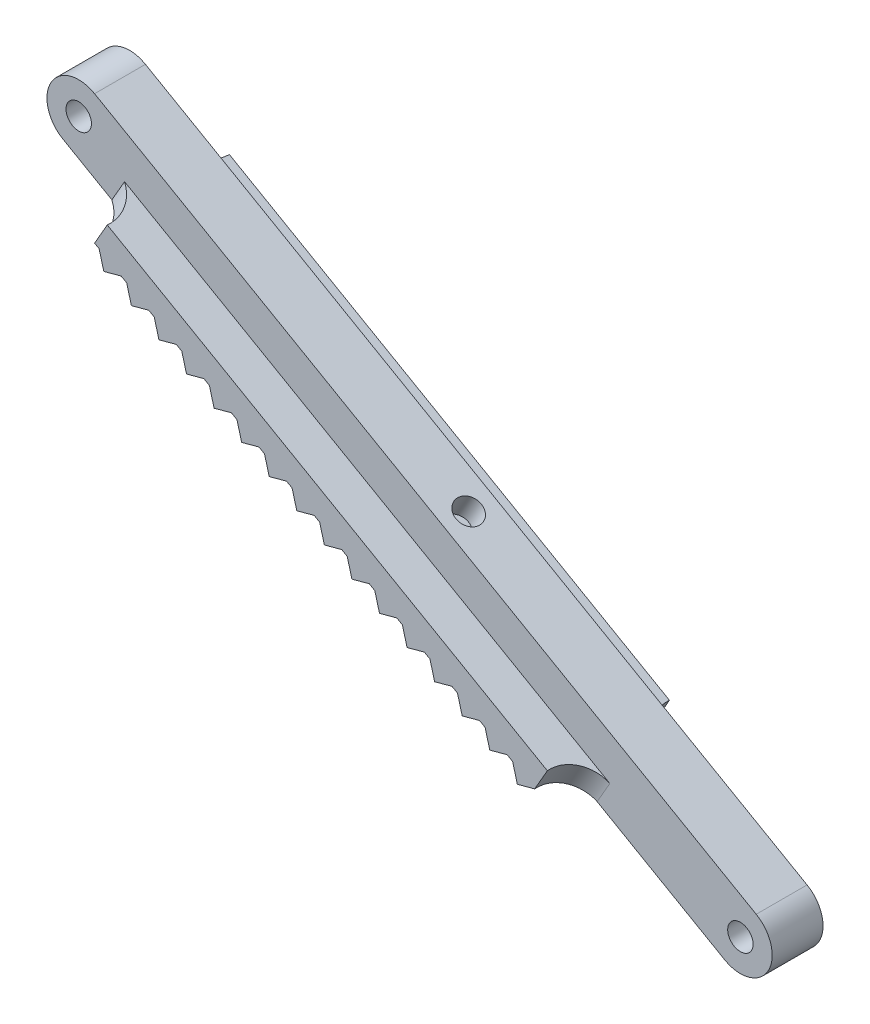
from build123d import *

# Parameters (mm, degrees)
SKETCH1_R           = 1
BOSS_EXTRUDE1_DEPTH = 4
SKETCH2_R           = 1
CUT_EXTRUDE1_DEPTH  = 2
BOSS_EXTRUDE2_DEPTH = 2
BOSS_EXTRUDE3_REACH = 89.691


with BuildPart() as part:
    # Sketch1 → Boss-Extrude1 (new body)
    with BuildSketch(Plane.XY):
        with BuildLine():
            Line((-56.056622595, 63.083032854), (-4.020390364, 33.212804613))
            ThreePointArc((-4.020390364, 33.212804613), (-3.096806864, 29.800035426), (-6.509576051, 28.876451927))
            Line((-6.509576051, 28.876451927), (-58.545808282, 58.746680168))
            ThreePointArc((-58.545808282, 58.746680168), (-59.469391781, 62.159449355), (-56.056622595, 63.083032854))
        make_face()
        with Locations((-57.301215438, 60.914856511)):
            Circle(SKETCH1_R, mode=Mode.SUBTRACT)
        with Locations((-5.264983207, 31.04462827)):
            Circle(SKETCH1_R, mode=Mode.SUBTRACT)
    extrude(amount=BOSS_EXTRUDE1_DEPTH)

    # Sketch2 → Cut-Extrude1 (cut)
    with BuildSketch(Plane(origin=(13.343522454, 23.245441166, 0), x_dir=(0.8672705371832455, -0.49783713735908147, 0), z_dir=(0.49783713735908147, 0.8672705371832455, 0))):
        with Locations(Location((-48.403705156, -2, 0), (0, 0, 180))):
            Circle(SKETCH2_R)
    extrude(amount=-CUT_EXTRUDE1_DEPTH, mode=Mode.SUBTRACT)

    # Sketch4 → Boss-Extrude2 (add)
    with BuildSketch(Plane(origin=(10.854336767, 18.90908848, 0), x_dir=(0.8672705371832455, -0.49783713735908136, 0), z_dir=(-0.49783713735908136, -0.8672705371832455, 0))):
        with BuildLine():
            Line((-73.918626185, 6.8), (-34.010435963, 6.8))
            ThreePointArc((-34.010435963, 6.8), (-33.372509372, 4.895560129), (-31.574784807, 4))
            Line((-31.574784807, 4), (-31.574784807, 0))
            ThreePointArc((-31.574784807, 0), (-33.372509372, -0.895560129), (-34.010435963, -2.8))
            Line((-34.010435963, -2.8), (-73.918626185, -2.8))
            ThreePointArc((-73.918626185, -2.8), (-74.749293349, -0.809525322), (-76.748459708, 0))
            Line((-76.748459708, 0), (-75.579913588, 4))
            ThreePointArc((-75.579913588, 4), (-74.306304145, 5.137180927), (-73.918626185, 6.8))
        make_face()
    extrude(amount=-BOSS_EXTRUDE2_DEPTH)

    # Boss-Extrude3: up to this face of the body (flat: up to its plane)
    boss_extrude3_end = Plane(part.part.faces().sort_by_distance((-35.449673949, 46.641906686, 6.8))[0])
    # Sketch5 → Boss-Extrude3 (add, up to the picked face)
    with BuildSketch(Plane(origin=(0, 0, -2.8), x_dir=(-1, 0, 0), z_dir=(0, 0, -1)), mode=Mode.PRIVATE) as boss_extrude3_sk1:
        Polygon((52.899098519, 55.505313486), (51.164557445, 54.509639211), (52.529665119, 54.140205811), align=None)
    boss_extrude3_tool1 = split(extrude(boss_extrude3_sk1.sketch, amount=-BOSS_EXTRUDE3_REACH, mode=Mode.PRIVATE), bisect_by=boss_extrude3_end, keep=Keep.BOTH, mode=Mode.PRIVATE)
    # Sketch5 → Boss-Extrude3 (add, up to the picked face)
    with BuildSketch(Plane(origin=(0, 0, -2.8), x_dir=(-1, 0, 0), z_dir=(0, 0, -1)), mode=Mode.PRIVATE) as boss_extrude3_sk2:
        Polygon((18.6419123, 35.84074656), (20.007019975, 35.47131316), (20.376453374, 36.836420835), align=None)
    boss_extrude3_tool2 = split(extrude(boss_extrude3_sk2.sketch, amount=-BOSS_EXTRUDE3_REACH, mode=Mode.PRIVATE), bisect_by=boss_extrude3_end, keep=Keep.BOTH, mode=Mode.PRIVATE)
    # Sketch5 → Boss-Extrude3 (add, up to the picked face)
    with BuildSketch(Plane(origin=(0, 0, -2.8), x_dir=(-1, 0, 0), z_dir=(0, 0, -1)), mode=Mode.PRIVATE) as boss_extrude3_sk3:
        Polygon((20.810088643, 37.085339404), (22.175196318, 36.715906004), (22.544629717, 38.081013678), align=None)
    boss_extrude3_tool3 = split(extrude(boss_extrude3_sk3.sketch, amount=-BOSS_EXTRUDE3_REACH, mode=Mode.PRIVATE), bisect_by=boss_extrude3_end, keep=Keep.BOTH, mode=Mode.PRIVATE)
    # Sketch5 → Boss-Extrude3 (add, up to the picked face)
    with BuildSketch(Plane(origin=(0, 0, -2.8), x_dir=(-1, 0, 0), z_dir=(0, 0, -1)), mode=Mode.PRIVATE) as boss_extrude3_sk4:
        Polygon((22.978264986, 38.329932247), (24.343372661, 37.960498847), (24.71280606, 39.325606522), align=None)
    boss_extrude3_tool4 = split(extrude(boss_extrude3_sk4.sketch, amount=-BOSS_EXTRUDE3_REACH, mode=Mode.PRIVATE), bisect_by=boss_extrude3_end, keep=Keep.BOTH, mode=Mode.PRIVATE)
    # Sketch5 → Boss-Extrude3 (add, up to the picked face)
    with BuildSketch(Plane(origin=(0, 0, -2.8), x_dir=(-1, 0, 0), z_dir=(0, 0, -1)), mode=Mode.PRIVATE) as boss_extrude3_sk5:
        Polygon((25.146441329, 39.57452509), (26.511549004, 39.205091691), (26.880982403, 40.570199365), align=None)
    boss_extrude3_tool5 = split(extrude(boss_extrude3_sk5.sketch, amount=-BOSS_EXTRUDE3_REACH, mode=Mode.PRIVATE), bisect_by=boss_extrude3_end, keep=Keep.BOTH, mode=Mode.PRIVATE)
    # Sketch5 → Boss-Extrude3 (add, up to the picked face)
    with BuildSketch(Plane(origin=(0, 0, -2.8), x_dir=(-1, 0, 0), z_dir=(0, 0, -1)), mode=Mode.PRIVATE) as boss_extrude3_sk6:
        Polygon((27.314617672, 40.819117934), (28.679725347, 40.449684534), (29.049158746, 41.814792208), align=None)
    boss_extrude3_tool6 = split(extrude(boss_extrude3_sk6.sketch, amount=-BOSS_EXTRUDE3_REACH, mode=Mode.PRIVATE), bisect_by=boss_extrude3_end, keep=Keep.BOTH, mode=Mode.PRIVATE)
    # Sketch5 → Boss-Extrude3 (add, up to the picked face)
    with BuildSketch(Plane(origin=(0, 0, -2.8), x_dir=(-1, 0, 0), z_dir=(0, 0, -1)), mode=Mode.PRIVATE) as boss_extrude3_sk7:
        Polygon((29.482794015, 42.063710777), (30.847901689, 41.694277377), (31.217335089, 43.059385052), align=None)
    boss_extrude3_tool7 = split(extrude(boss_extrude3_sk7.sketch, amount=-BOSS_EXTRUDE3_REACH, mode=Mode.PRIVATE), bisect_by=boss_extrude3_end, keep=Keep.BOTH, mode=Mode.PRIVATE)
    # Sketch5 → Boss-Extrude3 (add, up to the picked face)
    with BuildSketch(Plane(origin=(0, 0, -2.8), x_dir=(-1, 0, 0), z_dir=(0, 0, -1)), mode=Mode.PRIVATE) as boss_extrude3_sk8:
        Polygon((31.650970358, 43.308303621), (33.016078032, 42.938870221), (33.385511432, 44.303977895), align=None)
    boss_extrude3_tool8 = split(extrude(boss_extrude3_sk8.sketch, amount=-BOSS_EXTRUDE3_REACH, mode=Mode.PRIVATE), bisect_by=boss_extrude3_end, keep=Keep.BOTH, mode=Mode.PRIVATE)
    # Sketch5 → Boss-Extrude3 (add, up to the picked face)
    with BuildSketch(Plane(origin=(0, 0, -2.8), x_dir=(-1, 0, 0), z_dir=(0, 0, -1)), mode=Mode.PRIVATE) as boss_extrude3_sk9:
        Polygon((33.819146701, 44.552896464), (35.184254375, 44.183463064), (35.553687775, 45.548570739), align=None)
    boss_extrude3_tool9 = split(extrude(boss_extrude3_sk9.sketch, amount=-BOSS_EXTRUDE3_REACH, mode=Mode.PRIVATE), bisect_by=boss_extrude3_end, keep=Keep.BOTH, mode=Mode.PRIVATE)
    # Sketch5 → Boss-Extrude3 (add, up to the picked face)
    with BuildSketch(Plane(origin=(0, 0, -2.8), x_dir=(-1, 0, 0), z_dir=(0, 0, -1)), mode=Mode.PRIVATE) as boss_extrude3_sk10:
        Polygon((35.987323044, 45.797489307), (37.352430718, 45.428055908), (37.721864118, 46.793163582), align=None)
    boss_extrude3_tool10 = split(extrude(boss_extrude3_sk10.sketch, amount=-BOSS_EXTRUDE3_REACH, mode=Mode.PRIVATE), bisect_by=boss_extrude3_end, keep=Keep.BOTH, mode=Mode.PRIVATE)
    # Sketch5 → Boss-Extrude3 (add, up to the picked face)
    with BuildSketch(Plane(origin=(0, 0, -2.8), x_dir=(-1, 0, 0), z_dir=(0, 0, -1)), mode=Mode.PRIVATE) as boss_extrude3_sk11:
        Polygon((38.155499387, 47.042082151), (39.520607061, 46.672648751), (39.890040461, 48.037756425), align=None)
    boss_extrude3_tool11 = split(extrude(boss_extrude3_sk11.sketch, amount=-BOSS_EXTRUDE3_REACH, mode=Mode.PRIVATE), bisect_by=boss_extrude3_end, keep=Keep.BOTH, mode=Mode.PRIVATE)
    # Sketch5 → Boss-Extrude3 (add, up to the picked face)
    with BuildSketch(Plane(origin=(0, 0, -2.8), x_dir=(-1, 0, 0), z_dir=(0, 0, -1)), mode=Mode.PRIVATE) as boss_extrude3_sk12:
        Polygon((40.32367573, 48.286674994), (41.688783404, 47.917241594), (42.058216804, 49.282349269), align=None)
    boss_extrude3_tool12 = split(extrude(boss_extrude3_sk12.sketch, amount=-BOSS_EXTRUDE3_REACH, mode=Mode.PRIVATE), bisect_by=boss_extrude3_end, keep=Keep.BOTH, mode=Mode.PRIVATE)
    # Sketch5 → Boss-Extrude3 (add, up to the picked face)
    with BuildSketch(Plane(origin=(0, 0, -2.8), x_dir=(-1, 0, 0), z_dir=(0, 0, -1)), mode=Mode.PRIVATE) as boss_extrude3_sk13:
        Polygon((42.491852073, 49.531267838), (43.856959747, 49.161834438), (44.226393147, 50.526942112), align=None)
    boss_extrude3_tool13 = split(extrude(boss_extrude3_sk13.sketch, amount=-BOSS_EXTRUDE3_REACH, mode=Mode.PRIVATE), bisect_by=boss_extrude3_end, keep=Keep.BOTH, mode=Mode.PRIVATE)
    # Sketch5 → Boss-Extrude3 (add, up to the picked face)
    with BuildSketch(Plane(origin=(0, 0, -2.8), x_dir=(-1, 0, 0), z_dir=(0, 0, -1)), mode=Mode.PRIVATE) as boss_extrude3_sk14:
        Polygon((44.660028416, 50.775860681), (46.02513609, 50.406427281), (46.39456949, 51.771534956), align=None)
    boss_extrude3_tool14 = split(extrude(boss_extrude3_sk14.sketch, amount=-BOSS_EXTRUDE3_REACH, mode=Mode.PRIVATE), bisect_by=boss_extrude3_end, keep=Keep.BOTH, mode=Mode.PRIVATE)
    # Sketch5 → Boss-Extrude3 (add, up to the picked face)
    with BuildSketch(Plane(origin=(0, 0, -2.8), x_dir=(-1, 0, 0), z_dir=(0, 0, -1)), mode=Mode.PRIVATE) as boss_extrude3_sk15:
        Polygon((46.828204759, 52.020453524), (48.193312433, 51.651020125), (48.562745833, 53.016127799), align=None)
    boss_extrude3_tool15 = split(extrude(boss_extrude3_sk15.sketch, amount=-BOSS_EXTRUDE3_REACH, mode=Mode.PRIVATE), bisect_by=boss_extrude3_end, keep=Keep.BOTH, mode=Mode.PRIVATE)
    # Sketch5 → Boss-Extrude3 (add, up to the picked face)
    with BuildSketch(Plane(origin=(0, 0, -2.8), x_dir=(-1, 0, 0), z_dir=(0, 0, -1)), mode=Mode.PRIVATE) as boss_extrude3_sk16:
        Polygon((48.996381102, 53.265046368), (50.361488776, 52.895612968), (50.730922176, 54.260720642), align=None)
    boss_extrude3_tool16 = split(extrude(boss_extrude3_sk16.sketch, amount=-BOSS_EXTRUDE3_REACH, mode=Mode.PRIVATE), bisect_by=boss_extrude3_end, keep=Keep.BOTH, mode=Mode.PRIVATE)
    add(boss_extrude3_tool1.solids().sort_by(Axis((-52.197774, 54.718386, -2.8), (0, 0, 1)))[0])
    add(boss_extrude3_tool2.solids().sort_by(Axis((-19.675129, 36.049494, -2.8), (0, 0, 1)))[0])
    add(boss_extrude3_tool3.solids().sort_by(Axis((-21.843305, 37.294086, -2.8), (0, 0, 1)))[0])
    add(boss_extrude3_tool4.solids().sort_by(Axis((-24.011481, 38.538679, -2.8), (0, 0, 1)))[0])
    add(boss_extrude3_tool5.solids().sort_by(Axis((-26.179658, 39.783272, -2.8), (0, 0, 1)))[0])
    add(boss_extrude3_tool6.solids().sort_by(Axis((-28.347834, 41.027865, -2.8), (0, 0, 1)))[0])
    add(boss_extrude3_tool7.solids().sort_by(Axis((-30.51601, 42.272458, -2.8), (0, 0, 1)))[0])
    add(boss_extrude3_tool8.solids().sort_by(Axis((-32.684187, 43.517051, -2.8), (0, 0, 1)))[0])
    add(boss_extrude3_tool9.solids().sort_by(Axis((-34.852363, 44.761643, -2.8), (0, 0, 1)))[0])
    add(boss_extrude3_tool10.solids().sort_by(Axis((-37.020539, 46.006236, -2.8), (0, 0, 1)))[0])
    add(boss_extrude3_tool11.solids().sort_by(Axis((-39.188716, 47.250829, -2.8), (0, 0, 1)))[0])
    add(boss_extrude3_tool12.solids().sort_by(Axis((-41.356892, 48.495422, -2.8), (0, 0, 1)))[0])
    add(boss_extrude3_tool13.solids().sort_by(Axis((-43.525068, 49.740015, -2.8), (0, 0, 1)))[0])
    add(boss_extrude3_tool14.solids().sort_by(Axis((-45.693245, 50.984608, -2.8), (0, 0, 1)))[0])
    add(boss_extrude3_tool15.solids().sort_by(Axis((-47.861421, 52.2292, -2.8), (0, 0, 1)))[0])
    add(boss_extrude3_tool16.solids().sort_by(Axis((-50.029597, 53.473793, -2.8), (0, 0, 1)))[0])


solid = part.part
